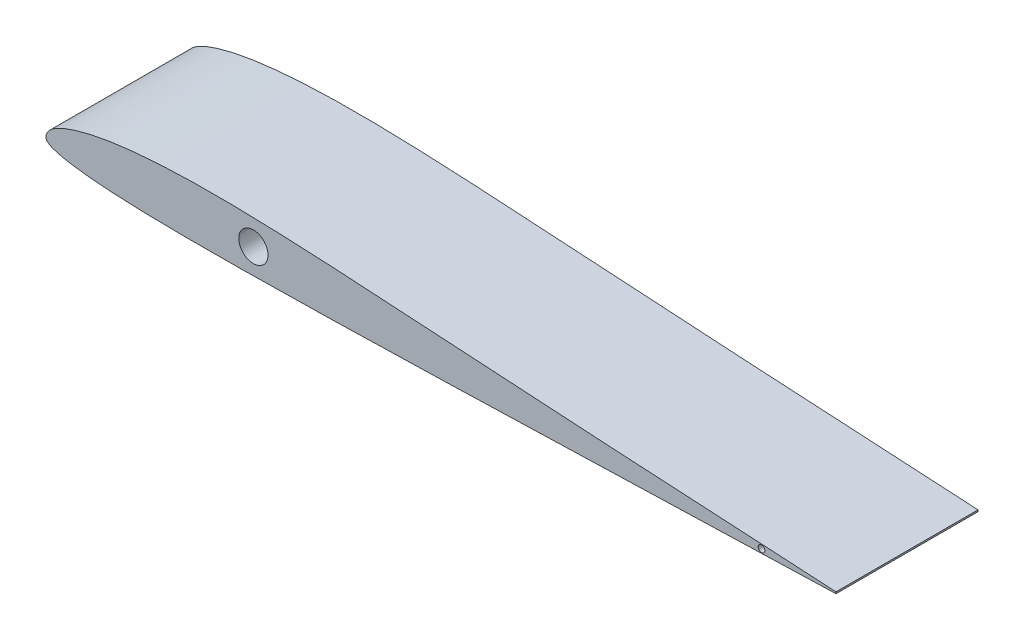
from build123d import *

# Parameters (mm, degrees)
AIRFOIL_DEPTH        = 36.5252
CAMERA_CHANNEL_REACH = 208.647
SKETCH8_R            = 3.7592
SKETCH9_R            = 0.8636
CUT_EXTRUDE1_DEPTH   = 207.646588533


with BuildPart() as part:
    # Sketch3 → Airfoil (new body)
    with BuildSketch(Plane.XY):
        with BuildLine():
            Line((203.2026416, 0.2115312), (203.1973584, -0.2115312))
            add(Edge.make_bspline(
                [(203.2026416, 0.2115312), (202.749975414, 0.235767735), (201.482227455, 0.303645165), (199.229899451, 0.427581862), (196.304631843, 0.58645357), (192.978703522, 0.769351745), (189.375038631, 0.970599063), (185.612938037, 1.178498421), (181.773697727, 1.395742795), (177.899622281, 1.614727685), (174.009999544, 1.835420869), (170.113241345, 2.055248875), (166.213278896, 2.277505712), (162.311711246, 2.498550948), (158.410741475, 2.722039599), (154.51059314, 2.944050358), (150.614228349, 3.167765812), (146.720449867, 3.393606246), (142.830938385, 3.617021658), (138.944036437, 3.845362214), (135.059465523, 4.072120956), (131.177542014, 4.301224247), (127.296716125, 4.531457234), (123.418858544, 4.764935655), (119.542057199, 5.000803845), (115.667451592, 5.239845443), (111.794903734, 5.481590715), (107.92356364, 5.724700666), (104.057153857, 5.968055719), (100.189436188, 6.212019472), (96.318759225, 6.454299415), (92.447746967, 6.694605077), (88.584023823, 6.932155402), (84.741460885, 7.163725688), (80.922901098, 7.388921542), (77.397782248, 7.59058238), (74.522903974, 7.749287039), (71.994617804, 7.884276403), (69.124106699, 8.032386004), (65.508268577, 8.20759336), (61.485211762, 8.383132514), (57.521769068, 8.532806767), (53.67337931, 8.65196061), (49.905829014, 8.739019457), (46.180960609, 8.791245505), (42.490964532, 8.80473096), (38.846800487, 8.774220372), (35.259629974, 8.696203332), (31.756076473, 8.567101257), (28.366063073, 8.385637047), (25.12916512, 8.151985933), (22.079780002, 7.868751339), (19.258728777, 7.54280933), (16.701884478, 7.183689544), (14.433629815, 6.805801873), (12.454092042, 6.421559693), (10.747122797, 6.041820295), (9.282979556, 5.674052725), (8.026380981, 5.32164067), (6.939364861, 4.984377042), (5.987597489, 4.659887308), (5.142872565, 4.34265889), (4.375389754, 4.030109088), (3.657744375, 3.708063164), (2.964607554, 3.360683786), (2.286752141, 2.970800639), (1.638361257, 2.53049627), (1.049962466, 2.035518438), (0.55105342, 1.482304271), (0.182124171, 0.879494893), (0.020226764, 0.365089231), (-0.006478658, -0.019297801), (0.019393578, -0.313623078), (0.126773921, -0.614429835), (0.296985654, -0.854594391), (0.474203046, -1.0360418), (0.692231827, -1.205448428), (0.984641636, -1.3848123), (1.352473451, -1.566840486), (1.779379473, -1.744801104), (2.260500407, -1.917169047), (2.806664849, -2.087583046), (3.441332814, -2.260164552), (4.188115361, -2.438004982), (5.06690206, -2.621532136), (6.092157789, -2.806861911), (7.276571085, -2.993059902), (8.634334508, -3.178000051), (10.186878433, -3.35940408), (11.960820402, -3.536894099), (13.988248891, -3.707664418), (16.294928682, -3.868904436), (18.89372996, -4.015528606), (21.766154486, -4.143679461), (24.87293007, -4.249244795), (28.158435839, -4.329742718), (31.577459925, -4.386681674), (35.091351007, -4.420650673), (38.679106505, -4.435118029), (42.321638443, -4.431127332), (46.012586406, -4.412453932), (49.757901166, -4.379533307), (53.580508995, -4.337179517), (57.514943683, -4.284200631), (61.595949927, -4.220224301), (65.884086903, -4.144461591), (69.583989281, -4.072095586), (72.808820505, -4.005043155), (75.579862857, -3.944754288), (78.770794894, -3.87272284), (82.213745044, -3.790898591), (85.812278509, -3.702057045), (89.454775682, -3.609141494), (93.150227317, -3.511616573), (96.888909494, -3.411069637), (100.657029944, -3.306886052), (104.439744756, -3.201756582), (108.224810971, -3.094514402), (112.008194618, -2.986301144), (115.791031649, -2.876635979), (119.578217649, -2.765818396), (123.376483987, -2.65229883), (127.194486092, -2.537598816), (131.04164704, -2.420012089), (134.919802339, -2.301989441), (138.81936176, -2.182338271), (142.726333168, -2.060156236), (146.633431624, -1.937306429), (150.540542811, -1.8169006), (154.447614149, -1.693516374), (158.354722861, -1.573509134), (162.26148206, -1.451514239), (166.167503923, -1.331681527), (170.071797885, -1.208888837), (173.972889131, -1.08970993), (177.866894682, -0.967751167), (181.74532249, -0.848820183), (185.588910116, -0.731171396), (189.354936457, -0.616949477), (192.962622684, -0.509627047), (196.29203641, -0.412964276), (199.220341745, -0.324818889), (201.475188064, -0.261715668), (202.74429193, -0.224733669), (203.1973584, -0.2115312)],
                knots=[0, 0, 0, 0, 0.003315783, 0.009286262, 0.01649964, 0.024744274, 0.033650618, 0.042899826, 0.052304254, 0.061777775, 0.071282103, 0.080800776, 0.090326048, 0.099854782, 0.109384674, 0.118906596, 0.128428716, 0.137931689, 0.147435622, 0.156925556, 0.166411563, 0.175897802, 0.185369409, 0.194847889, 0.20431387, 0.213778822, 0.22324269, 0.232694875, 0.242151635, 0.251579623, 0.261041636, 0.270519226, 0.279948764, 0.289356316, 0.298676754, 0.307928254, 0.315183044, 0.31973714, 0.326447814, 0.336207398, 0.346216249, 0.35590244, 0.365218591, 0.374378655, 0.38346733, 0.392466507, 0.40136886, 0.410122896, 0.418710299, 0.427012022, 0.434953476, 0.442446764, 0.449411134, 0.455723479, 0.461330459, 0.466229103, 0.470471324, 0.474119786, 0.477269946, 0.48001617, 0.482443707, 0.48462406, 0.486615379, 0.48850422, 0.490376245, 0.492284157, 0.494220159, 0.496101738, 0.49789553, 0.499645689, 0.501236957, 0.501776184, 0.502456996, 0.50338555, 0.504071488, 0.504595279, 0.505236101, 0.506085552, 0.507100329, 0.508234964, 0.509466926, 0.51083723, 0.512418824, 0.514276846, 0.516451552, 0.518984588, 0.521896832, 0.525220723, 0.529007031, 0.533329617, 0.538260507, 0.543888673, 0.550242528, 0.557299236, 0.564919576, 0.572979857, 0.581338081, 0.589931372, 0.59868335, 0.607580916, 0.616574706, 0.62568118, 0.63497715, 0.644536982, 0.654462302, 0.664831439, 0.675907565, 0.68153051, 0.688424661, 0.696181232, 0.704876621, 0.713615329, 0.722510831, 0.73152844, 0.74065523, 0.749867421, 0.759101002, 0.768334695, 0.777564511, 0.786785993, 0.796015995, 0.805277853, 0.814580932, 0.823955486, 0.833431168, 0.842960949, 0.852492353, 0.862022798, 0.871553661, 0.881084601, 0.890615434, 0.900145802, 0.909674638, 0.919199589, 0.928717996, 0.938222598, 0.947696375, 0.957100207, 0.966349803, 0.975255754, 0.983500408, 0.990713161, 0.996684625, 1, 1, 1, 1], degree=3))
        make_face()
    extrude(amount=AIRFOIL_DEPTH)

    # Sketch8 → Camera Channel (cut, up to next)
    with BuildSketch(Plane(origin=(0, 0, 0), x_dir=(-1, 0, 0), z_dir=(0, 0, -1)), mode=Mode.PRIVATE) as camera_channel_sk1:
        with Locations((-53.339999981, 2.15866289)):
            Circle(SKETCH8_R)
    camera_channel_tool1 = extrude(camera_channel_sk1.sketch, amount=-CAMERA_CHANNEL_REACH, mode=Mode.PRIVATE) & part.part
    add(camera_channel_tool1.solids().sort_by_distance((53.34, 2.158663, 0))[0], mode=Mode.SUBTRACT)

    # Sketch9 → Cut-Extrude1 (cut, through all)
    with BuildSketch(Plane(origin=(0, 0, 0), x_dir=(-1, 0, 0), z_dir=(0, 0, -1))):
        with Locations((-184.0510416, 0.244383133)):
            Circle(SKETCH9_R)
    extrude(amount=-CUT_EXTRUDE1_DEPTH, mode=Mode.SUBTRACT)


solid = part.part
